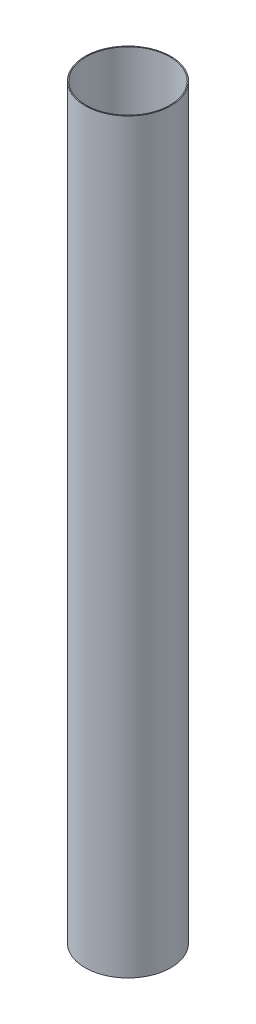
from build123d import *

# Parameters (mm, degrees)
SKETCH1_R           = 87.5284
SKETCH1_R_2         = 85.6234
BOSS_EXTRUDE1_DEPTH = 1524


with BuildPart() as part:
    # Sketch1 → Boss-Extrude1 (new body)
    with BuildSketch(Plane(origin=(0, 0, 0), x_dir=(1, 0, 0), z_dir=(0, 1, 0))):
        with Locations(Location((0, 0, 0), (0, 0, 270))):
            Circle(SKETCH1_R)
        with Locations(Location((0, 0, 0), (0, 0, 270))):
            Circle(SKETCH1_R_2, mode=Mode.SUBTRACT)
    extrude(amount=BOSS_EXTRUDE1_DEPTH)


solid = part.part
